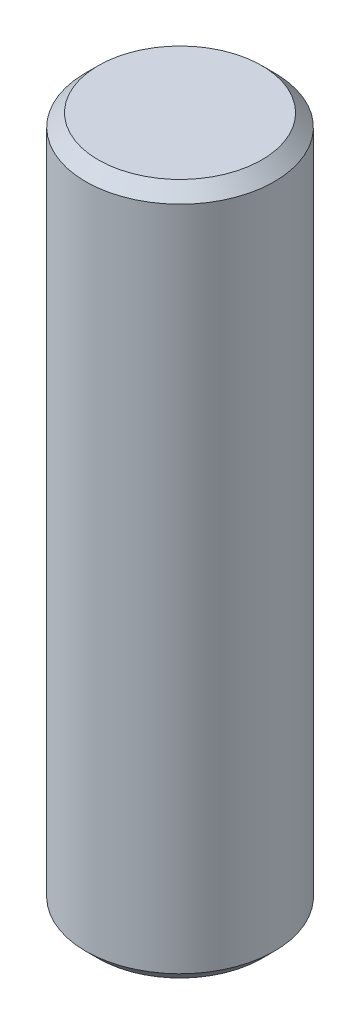
from build123d import *

# Parameters (mm, degrees)
SKETCH1_R           = 3
BOSS_EXTRUDE1_DEPTH = 22
CHAMFER1_SIZE       = 0.4


with BuildPart() as part:
    # Sketch1 → Boss-Extrude1 (new body)
    with BuildSketch(Plane(origin=(0, 0, 0), x_dir=(1, 0, 0), z_dir=(0, 1, 0))):
        Circle(SKETCH1_R)
    extrude(amount=BOSS_EXTRUDE1_DEPTH)

    # Chamfer1
    chamfer1_edges = [part.edges().sort_by_distance(p)[0] for p in [
        (-3, 0, 0),
        (-3, 22, 0),
    ]]
    chamfer(chamfer1_edges, length=CHAMFER1_SIZE)


solid = part.part
